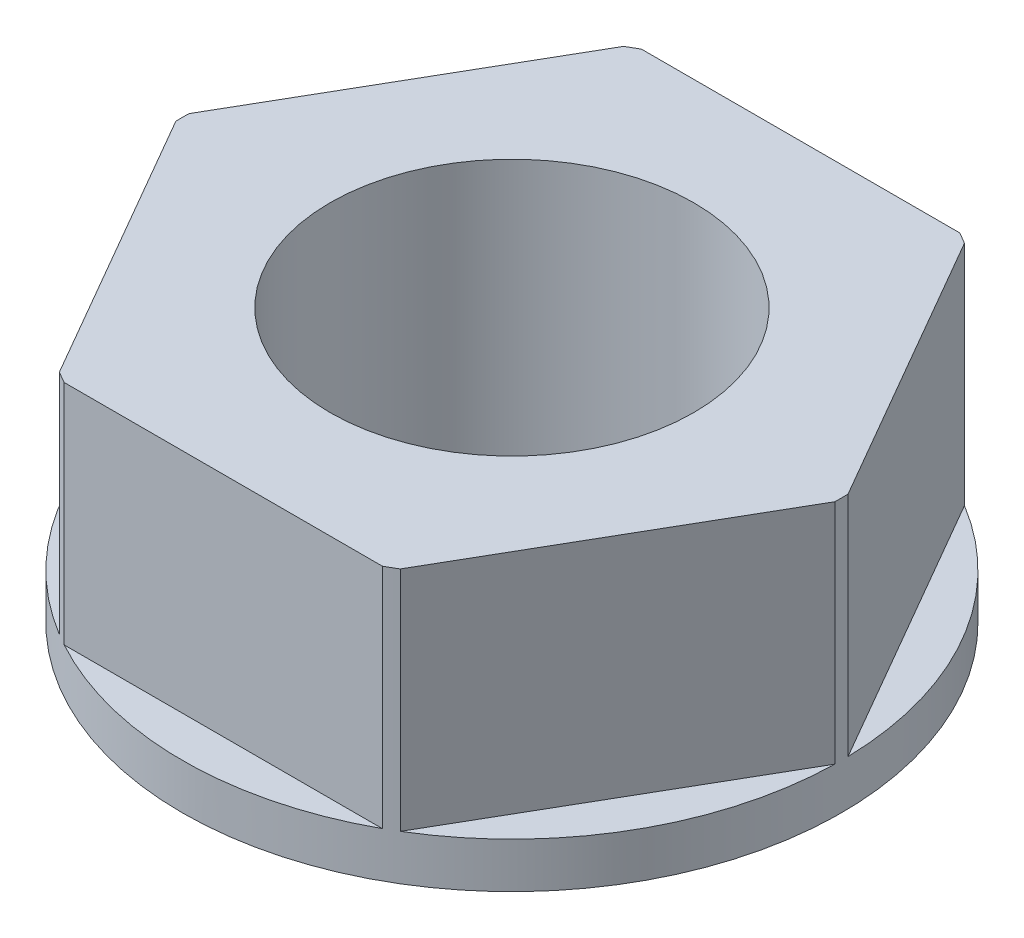
from build123d import *

# Parameters (mm, degrees)
SKETCH1_R           = 7.25
BOSS_EXTRUDE1_DEPTH = 1
BOSS_EXTRUDE2_DEPTH = 5
SKETCH3_R           = 4
CUT_EXTRUDE1_DEPTH  = 12.879604371


with BuildPart() as part:
    # Sketch1 → Boss-Extrude1 (new body)
    with BuildSketch(Plane(origin=(0, 0, 0), x_dir=(1, 0, 0), z_dir=(0, 1, 0))):
        with Locations(Location((0, 0, 0), (0, 0, 270))):
            Circle(SKETCH1_R)
    extrude(amount=BOSS_EXTRUDE1_DEPTH)

    # Sketch2 → Boss-Extrude2 (add)
    with BuildSketch(Plane(origin=(0, 1, 0), x_dir=(1, 0, 0), z_dir=(0, 1, 0))):
        with BuildLine():
            ThreePointArc((3.749975746, 6.204851482), (3.625, 6.278684177), (3.498571137, 6.35))
            Line((3.498571137, 6.35), (-3.498571137, 6.35))
            ThreePointArc((-3.498571137, 6.35), (-3.625, 6.278684177), (-3.749975746, 6.204851482))
            Line((-3.749975746, 6.204851482), (-7.248546882, 0.145148518))
            ThreePointArc((-7.248546882, 0.145148518), (-7.25, 0), (-7.248546882, -0.145148518))
            Line((-7.248546882, -0.145148518), (-3.749975746, -6.204851482))
            ThreePointArc((-3.749975746, -6.204851482), (-3.625, -6.278684177), (-3.498571137, -6.35))
            Line((-3.498571137, -6.35), (3.498571137, -6.35))
            ThreePointArc((3.498571137, -6.35), (3.625, -6.278684177), (3.749975746, -6.204851482))
            Line((3.749975746, -6.204851482), (7.248546882, -0.145148518))
            ThreePointArc((7.248546882, -0.145148518), (7.249636712, -0.072577896), (7.25, 0))
            ThreePointArc((7.25, 0), (7.249636712, 0.072577896), (7.248546882, 0.145148518))
            Line((7.248546882, 0.145148518), (3.749975746, 6.204851482))
        make_face()
    extrude(amount=BOSS_EXTRUDE2_DEPTH)

    # Sketch3 → Cut-Extrude1 (cut, through all)
    with BuildSketch(Plane(origin=(0, 6, 0), x_dir=(1, 0, 0), z_dir=(0, 1, 0))):
        with Locations(Location((0, 0, 0), (0, 0, 270))):
            Circle(SKETCH3_R)
    extrude(amount=-CUT_EXTRUDE1_DEPTH, mode=Mode.SUBTRACT)


solid = part.part
